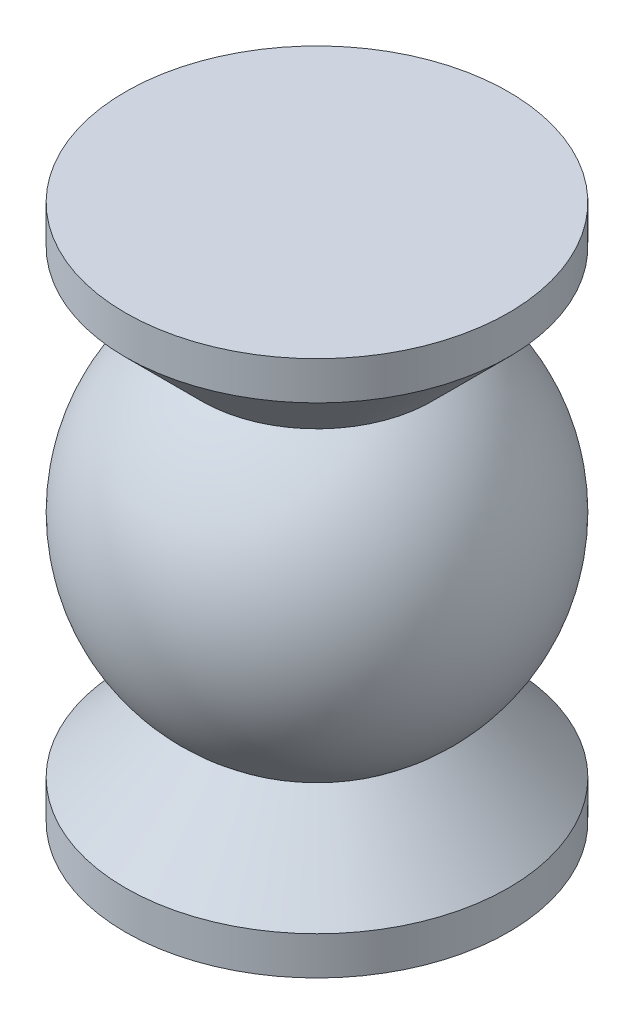
from build123d import *


with BuildPart() as part:
    # 草图1 → 旋转1 (revolve)
    with BuildSketch(Plane(origin=(0, 0, 0), x_dir=(0, 0, -1), z_dir=(1, 0, 0)), mode=Mode.PRIVATE) as revolve_1_sk:
        with BuildLine():
            Line((0, 35), (0, 20))
            Line((0, 20), (0, -20))
            Line((0, -20), (0, -35))
            Line((0, -35), (25, -35))
            Line((25, -35), (25, -30))
            Line((25, -30), (15, -20))
            ThreePointArc((15, -20), (25, 0), (15, 20))
            Line((15, 20), (25, 30))
            Line((25, 30), (25, 35))
            Line((25, 35), (0, 35))
        make_face()
    revolve(revolve_1_sk.sketch.rotate(Axis((0, 40.593511525, 0), (0, -1, 0)), 180), axis=Axis((0, 40.593511525, 0), (0, -1, 0)))


solid = part.part
